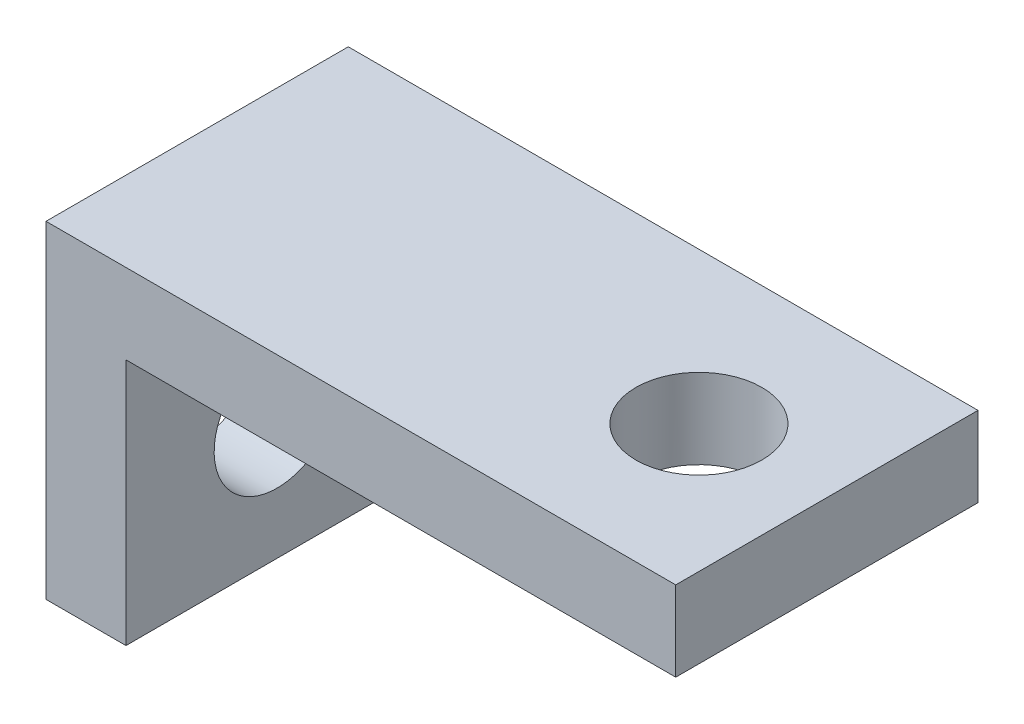
from build123d import *

# Parameters (mm, degrees)
SKETCH1_W           = 1.5875
SKETCH1_H           = 6.5
SKETCH1_W_2         = 10.9125
SKETCH1_H_2         = 1.5875
BOSS_EXTRUDE1_DEPTH = 6
SKETCH2_R           = 1.25
CUT_EXTRUDE1_DEPTH  = 6
SKETCH3_R           = 1.25
CUT_EXTRUDE2_DEPTH  = 6


with BuildPart() as part:
    # Sketch1 → Boss-Extrude1 (new body)
    with BuildSketch(Plane.XY):
        with Locations((0.41275, -0.74175)):
            Rectangle(SKETCH1_W, SKETCH1_H)
        with Locations((6.66275, 1.7145)):
            Rectangle(SKETCH1_W_2, SKETCH1_H_2)
    extrude(amount=BOSS_EXTRUDE1_DEPTH)

    # Sketch2 → Cut-Extrude1 (cut)
    with BuildSketch(Plane(origin=(1.2065, 0, 0), x_dir=(0, 0, -1), z_dir=(1, 0, 0))):
        with Locations(Location((-3, -1.5355, 0), (0, 0, 90))):
            Circle(SKETCH2_R)
    extrude(amount=-CUT_EXTRUDE1_DEPTH, mode=Mode.SUBTRACT)

    # Sketch3 → Cut-Extrude2 (cut)
    with BuildSketch(Plane.XZ.offset(-0.92075)):
        with Locations(Location((9.579, 3, 0), (0, 0, 270))):
            Circle(SKETCH3_R)
    extrude(amount=-CUT_EXTRUDE2_DEPTH, mode=Mode.SUBTRACT)


solid = part.part
